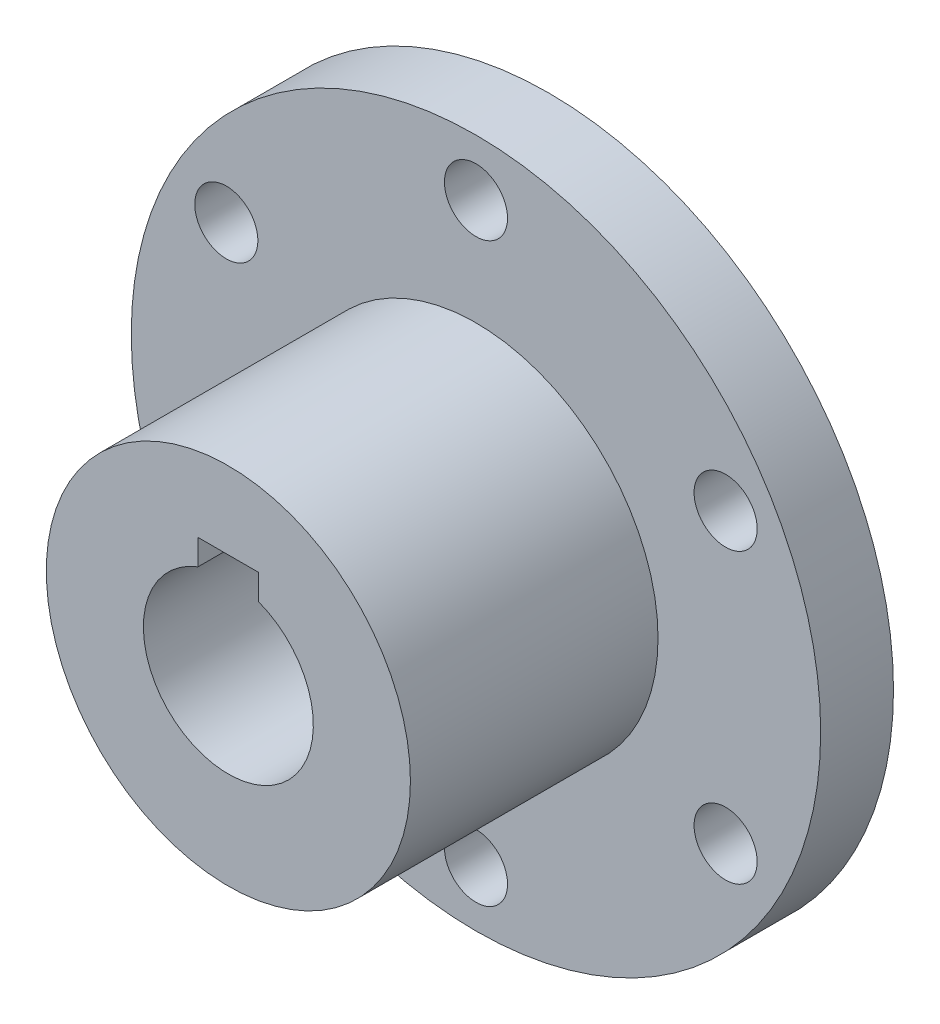
from build123d import *

# Parameters (mm, degrees)
SKETCH_1_R          = 28.4
EXTRUDE_1_DEPTH     = 6
SKETCH_2_R          = 15
EXTRUDE_2_DEPTH     = 20.4
SKETCH_3_R          = 7
CUT_EXTRUDE_1_DEPTH = 54.68780863
SKETCH_4_W          = 5
SKETCH_4_H          = 2.1
CUT_EXTRUDE_2_DEPTH = 54.68780863
SKETCH_5_R          = 2.6
CUT_EXTRUDE_3_DEPTH = 52.005693755


with BuildPart() as part:
    # 草图1 → 凸台-拉伸1 (new body)
    with BuildSketch(Plane.XY):
        with Locations((0, 8.733014899)):
            Circle(SKETCH_1_R)
    extrude(amount=EXTRUDE_1_DEPTH)

    # 草图2 → 凸台-拉伸2 (add)
    with BuildSketch(Plane.XY.offset(6)):
        with Locations((0, 8.733014899)):
            Circle(SKETCH_2_R)
    extrude(amount=EXTRUDE_2_DEPTH)

    # 草图3 → 切除-拉伸1 (cut, through all)
    with BuildSketch(Plane.XY.offset(26.4)):
        with Locations((0, 8.733014899)):
            Circle(SKETCH_3_R)
    extrude(amount=-CUT_EXTRUDE_1_DEPTH, mode=Mode.SUBTRACT)

    # 草图4 → 切除-拉伸2 (cut, through all)
    with BuildSketch(Plane.XY.offset(26.4)):
        with Locations((0, 16.321363314)):
            Rectangle(SKETCH_4_W, SKETCH_4_H)
    extrude(amount=-CUT_EXTRUDE_2_DEPTH, mode=Mode.SUBTRACT)

    # 草图5 → 切除-拉伸3 (cut, through all)
    with BuildSketch(Plane.XY.offset(6)):
        with Locations((0, 32.483014899)):
            Circle(SKETCH_5_R)
        with Locations((20.56810334, 20.608014899)):
            Circle(SKETCH_5_R)
        with Locations((20.56810334, -3.141985101)):
            Circle(SKETCH_5_R)
        with Locations((0, -15.016985101)):
            Circle(SKETCH_5_R)
        with Locations((-20.56810334, -3.141985101)):
            Circle(SKETCH_5_R)
        with Locations((-20.56810334, 20.608014899)):
            Circle(SKETCH_5_R)
    extrude(amount=-CUT_EXTRUDE_3_DEPTH, mode=Mode.SUBTRACT)


solid = part.part
